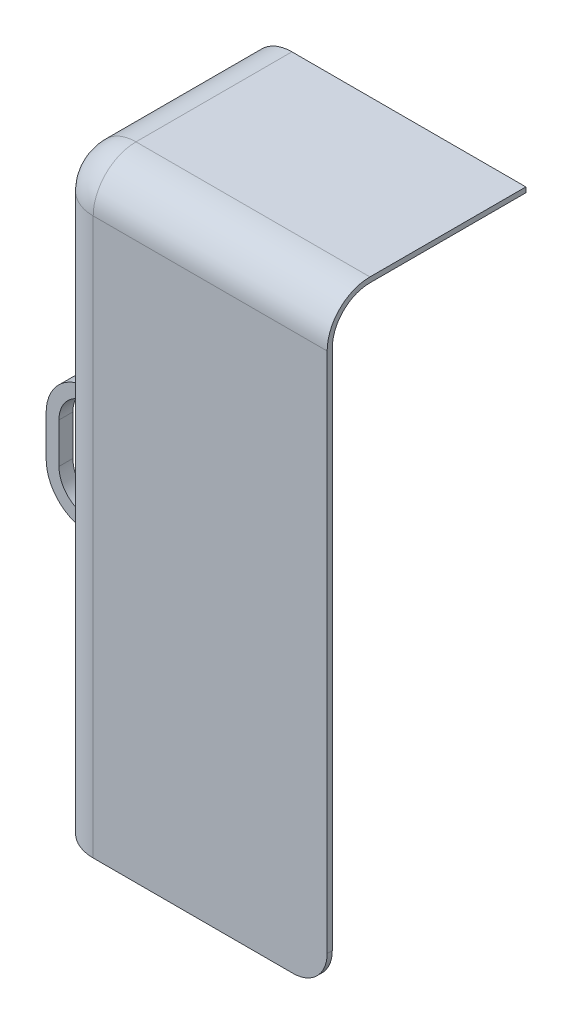
from build123d import *

# Parameters (mm, degrees)
BOSS_EXTRUDE1_DEPTH = 46.45
FILLET1_R           = 10
FILLET2_R           = 10
SHELL1_T            = -1.2
BOSS_EXTRUDE2_START = 10
SKETCH2_R           = 1.5
BOSS_EXTRUDE2_DEPTH = 2
CUT_EXTRUDE1_DEPTH  = 1.2
SKETCH4_W           = 3.252453774
SKETCH4_H           = 29.408591544
BOSS_EXTRUDE3_DEPTH = 11
FILLET3_R           = 10
CUT_EXTRUDE2_DEPTH  = 3.252453774


with BuildPart() as part:
    # Sketch1 → Boss-Extrude1 (new body)
    with BuildSketch(Plane.XY):
        with BuildLine():
            Line((-7.6, 131.988), (-72.288, 131.988))
            Line((-72.288, 131.988), (-72.288, -8))
            Line((-72.288, -8), (-15.6, -8))
            ThreePointArc((-15.6, -8), (-9.943145751, -5.656854249), (-7.6, 0))
            Line((-7.6, 0), (-7.6, 131.988))
        make_face()
    extrude(amount=BOSS_EXTRUDE1_DEPTH)

    # Fillet1
    fillet1_edges = [part.edges().sort_by_distance(p)[0] for p in [
        (-72.288, 131.988, 23.225),
    ]]
    fillet(fillet1_edges, radius=FILLET1_R)

    # Fillet2
    fillet2_edges = [part.edges().sort_by_distance(p)[0] for p in [
        (-72.288, 56.994, 46.45),
        (-69.359067812, 129.059067812, 46.45),
        (-34.944, 131.988, 46.45),
    ]]
    fillet(fillet2_edges, radius=FILLET2_R)

    # Shell1
    shell1_openings = [part.faces().sort_by_distance(p)[0] for p in [
        (-7.6, 65.770031668, 23.151264626),
        (-43.729452835, -8, 23.052515396),
        (-9.943145751, -5.656854249, 23.225),
        (-39.918891594, 61.936645467, 0),
    ]]
    offset(amount=SHELL1_T, openings=shell1_openings, kind=Kind.INTERSECTION)

    # Sketch2 → Boss-Extrude2 (add)
    # profile 1 of 2: a face of its own
    with BuildSketch(Plane.XY.offset(BOSS_EXTRUDE2_START)):
        with BuildLine():
            Line((-76.288, 120.488), (-72.288, 120.488))
            Line((-72.288, 120.488), (-72.288, 113.488))
            Line((-72.288, 113.488), (-76.288, 113.488))
            ThreePointArc((-76.288, 113.488), (-79.788, 116.988), (-76.288, 120.488))
        make_face()
        with Locations((-76.288, 116.988)):
            Circle(SKETCH2_R, mode=Mode.SUBTRACT)
    # profile 2 of 2: a face of its own
    with BuildSketch(Plane.XY.offset(BOSS_EXTRUDE2_START)):
        with BuildLine():
            Line((-76.288, 30.488), (-72.288, 30.488))
            Line((-72.288, 30.488), (-72.288, 23.488))
            Line((-72.288, 23.488), (-76.288, 23.488))
            ThreePointArc((-76.288, 23.488), (-79.788, 26.988), (-76.288, 30.488))
        make_face()
        with Locations((-76.288, 26.988)):
            Circle(SKETCH2_R, mode=Mode.SUBTRACT)
    extrude(amount=BOSS_EXTRUDE2_DEPTH)

    # Sketch3 → Cut-Extrude1 (cut)
    with BuildSketch(Plane.ZY.offset(72.288)):
        with BuildLine():
            Line((0, 12), (13.45, 12))
            ThreePointArc((13.45, 12), (33.45, -8), (13.45, -28))
            Line((13.45, -28), (0, -28))
            ThreePointArc((0, -28), (-20, -8), (0, 12))
        make_face()
    extrude(amount=-CUT_EXTRUDE1_DEPTH, mode=Mode.SUBTRACT)

    # Sketch4 → Boss-Extrude3 (add)
    with BuildSketch(Plane.ZY.offset(72.288)):
        with Locations((34.823773113, 61.979262262)):
            Rectangle(SKETCH4_W, SKETCH4_H)
    extrude(amount=BOSS_EXTRUDE3_DEPTH)

    # Fillet3
    fillet3_edges = [part.edges().sort_by_distance(p)[0] for p in [
        (-83.288, 76.683558034, 34.823773113),
        (-83.288, 47.27496649, 34.823773113),
    ]]
    fillet(fillet3_edges, radius=FILLET3_R)

    # Sketch5 → Cut-Extrude2 (cut)
    with BuildSketch(Plane.XY.offset(36.45)):
        with BuildLine():
            Line((-80.288, 66.683558034), (-80.288, 57.27496649))
            ThreePointArc((-80.288, 57.27496649), (-78.90048608, 53.091666357), (-75.288, 50.566762558))
            Line((-75.288, 50.566762558), (-75.288, 73.391761966))
            ThreePointArc((-75.288, 73.391761966), (-78.90048608, 70.866858166), (-80.288, 66.683558034))
        make_face()
    extrude(amount=-CUT_EXTRUDE2_DEPTH, mode=Mode.SUBTRACT)


solid = part.part
